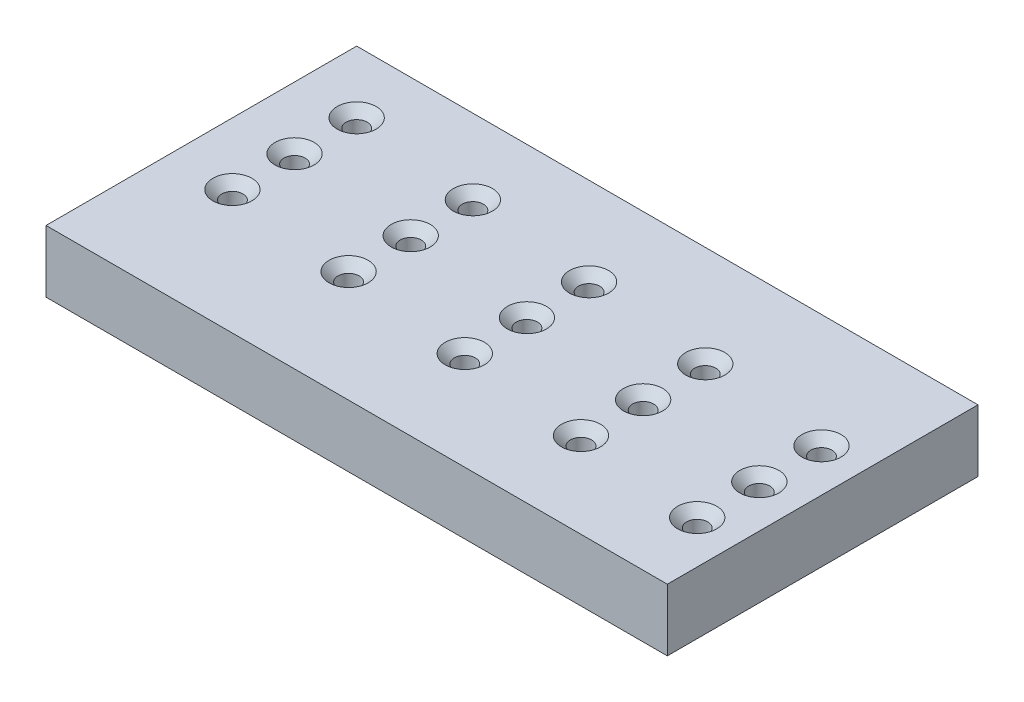
from build123d import *

# Parameters (mm, degrees)
SKETCH1_W                                       = 100
SKETCH1_H                                       = 50
BOSS_EXTRUDE1_DEPTH                             = 10
CSK_FOR_M3_FLAT_HEAD_MACHINE_SCREW1_D           = 3.4
CSK_FOR_M3_FLAT_HEAD_MACHINE_SCREW1_CSINK_D     = 6.3
CSK_FOR_M3_FLAT_HEAD_MACHINE_SCREW1_CSINK_ANGLE = 90
LPATTERN1_COUNT                                 = 5
LPATTERN1_PITCH                                 = 20.88337397
LPATTERN1_COUNT_DIR2                            = 3
LPATTERN1_PITCH_DIR2                            = 10


with BuildPart() as part:
    # Sketch1 → Boss-Extrude1 (new body)
    with BuildSketch(Plane(origin=(0, 0, 0), x_dir=(1, 0, 0), z_dir=(0, 1, 0))):
        Rectangle(SKETCH1_W, SKETCH1_H)
    extrude(amount=BOSS_EXTRUDE1_DEPTH)

    # CSK for M3 Flat Head Machine Screw1 (through all)
    with Locations(Plane(origin=(-40, 10, -15), x_dir=(0, 0, 1), z_dir=(0, 1, 0))):
        with Locations((0, 0)):
            csk_for_m3_flat_head_machine_screw1 = CounterSinkHole(CSK_FOR_M3_FLAT_HEAD_MACHINE_SCREW1_D / 2, CSK_FOR_M3_FLAT_HEAD_MACHINE_SCREW1_CSINK_D / 2, counter_sink_angle=CSK_FOR_M3_FLAT_HEAD_MACHINE_SCREW1_CSINK_ANGLE)

    # LPattern1: CSK for M3 Flat Head Machine Screw1 5 × 3
    with Locations(*[Vector(0.9950371902099892, 0, 0.099503719020999) * (i * LPATTERN1_PITCH) + Vector(0, 0, 1) * (j * LPATTERN1_PITCH_DIR2) for i in range(LPATTERN1_COUNT) for j in range(LPATTERN1_COUNT_DIR2) if (i, j) != (0, 0)]):
        add(csk_for_m3_flat_head_machine_screw1, mode=Mode.SUBTRACT)


solid = part.part
